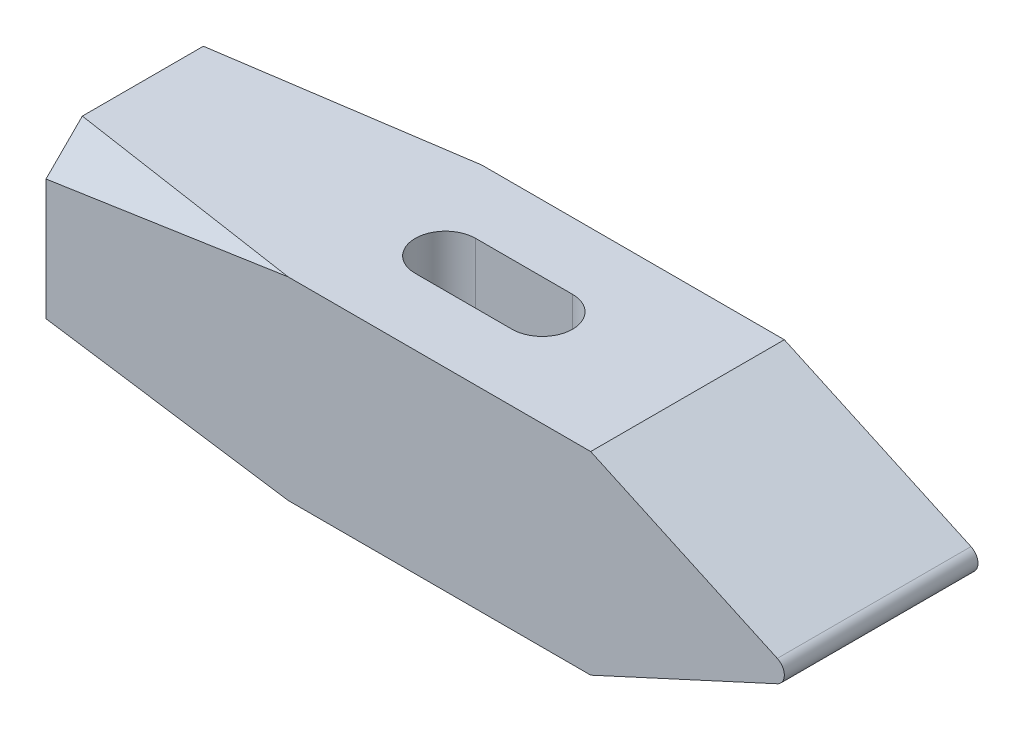
from build123d import *

# Parameters (mm, degrees)
BOSS_EXTRUDE1_DEPTH = 32
CUT_EXTRUDE1_DEPTH  = 32
CUT_EXTRUDE2_DEPTH  = 32
CUT_EXTRUDE3_DEPTH  = 32
CUT_EXTRUDE5_DEPTH  = 32
CUT_EXTRUDE6_DEPTH  = 32


with BuildPart() as part:
    # Sketch1 → Boss-Extrude1 (new body)
    with BuildSketch(Plane.XY):
        with BuildLine():
            Line((0, 16), (0, -16))
            Line((0, -16), (90, -16))
            Line((90, -16), (120.835740498, -1.817013434))
            ThreePointArc((120.835740498, -1.817013434), (122, 0), (120.835740498, 1.817013434))
            Line((120.835740498, 1.817013434), (90, 16))
            Line((90, 16), (0, 16))
        make_face()
    extrude(amount=BOSS_EXTRUDE1_DEPTH)

    # Sketch2 → Cut-Extrude1 (cut)
    with BuildSketch(Plane(origin=(0, 16, 0), x_dir=(1, 0, 0), z_dir=(0, 1, 0))):
        with BuildLine():
            Line((50, -11), (66, -11))
            ThreePointArc((66, -11), (71, -16), (66, -21))
            Line((66, -21), (50, -21))
            ThreePointArc((50, -21), (45, -16), (50, -11))
        make_face()
    extrude(amount=-CUT_EXTRUDE1_DEPTH, mode=Mode.SUBTRACT)

    # Sketch5 → Cut-Extrude2 (cut)
    with BuildSketch(Plane(origin=(-3.114956737, 20.766378245, 20.766378245), x_dir=(0.9944220203272567, 0.07458165152454437, 0.0745816515245444), z_dir=(-0.10547438309019469, 0.70316255393463, 0.70316255393463))):
        Polygon((3.132429364, -7.071067812), (3.132429364, -15.556349186), (43.356800086, -11.313708499), align=None)
    extrude(amount=CUT_EXTRUDE2_DEPTH, mode=Mode.SUBTRACT)

    # Sketch11 → Cut-Extrude3 (cut)
    with BuildSketch(Plane(origin=(-3.114956737, -20.766378245, 20.766378245), x_dir=(0.9944220203272567, -0.07458165152454421, 0.07458165152454423), z_dir=(-0.10547438309019447, -0.7031625539346299, 0.7031625539346302))):
        Polygon((43.356800086, 11.313708499), (3.132429364, 15.556349186), (3.132429364, 7.071067812), align=None)
    extrude(amount=CUT_EXTRUDE3_DEPTH, mode=Mode.SUBTRACT)

    # Sketch12 → Cut-Extrude5 (cut)
    with BuildSketch(Plane(origin=(-0.741656366, -4.944375773, -4.944375773), x_dir=(-0.9944220203272567, 0.07458165152454425, 0.07458165152454425), z_dir=(-0.10547438309019451, -0.70316255393463, -0.70316255393463))):
        Polygon((-40.970187237, -11.313708499), (-0.745816515, -7.071067812), (-0.745816515, -15.556349186), align=None)
    extrude(amount=CUT_EXTRUDE5_DEPTH, mode=Mode.SUBTRACT)

    # Sketch13 → Cut-Extrude6 (cut)
    with BuildSketch(Plane(origin=(-0.741656366, 4.944375773, -4.944375773), x_dir=(0.9944220203272567, 0.07458165152454421, -0.07458165152454421), z_dir=(0.10547438309019444, -0.70316255393463, 0.70316255393463))):
        Polygon((40.970187237, 11.313708499), (0.745816515, 7.071067812), (0.745816515, 15.556349186), align=None)
    extrude(amount=-CUT_EXTRUDE6_DEPTH, mode=Mode.SUBTRACT)


solid = part.part
